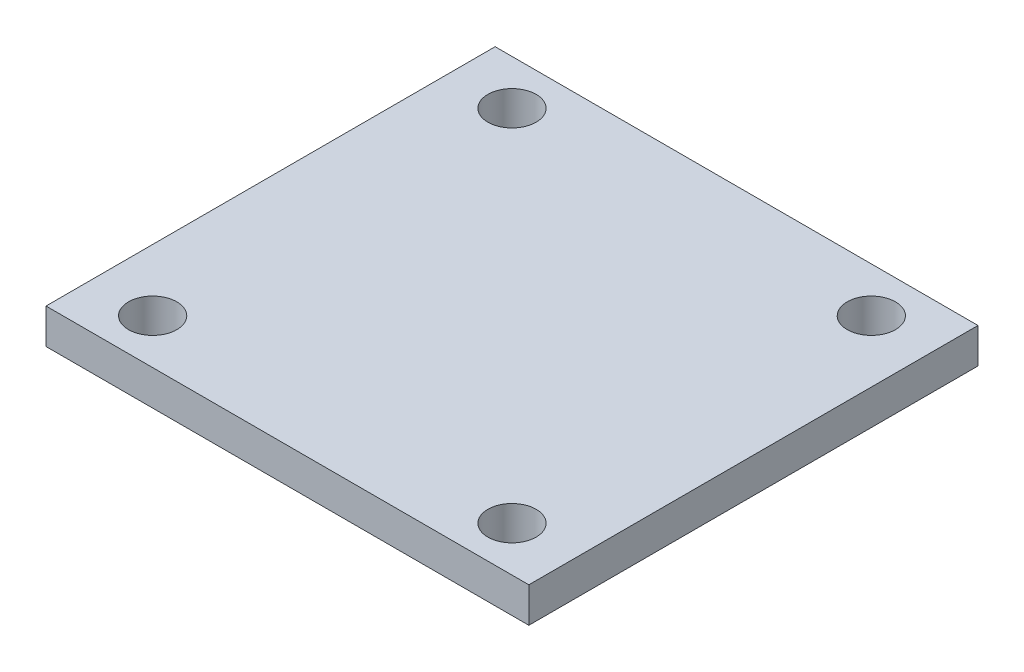
from build123d import *

# Parameters (mm, degrees)
SKETCH1_W            = 43
SKETCH1_H            = 40
BOSS_EXTRUDE1_DEPTH  = 3.125
M4_CLEARANCE_HOLE1_D = 4.3


with BuildPart() as part:
    # Sketch1 → Boss-Extrude1 (new body)
    with BuildSketch(Plane(origin=(0, 0, 0), x_dir=(1, 0, 0), z_dir=(0, 1, 0))):
        Rectangle(SKETCH1_W, SKETCH1_H)
    extrude(amount=BOSS_EXTRUDE1_DEPTH)

    # M4 Clearance Hole1 (through all)
    with Locations(Plane(origin=(0, 3.125, 0), x_dir=(1, 0, 0), z_dir=(0, 1, 0))):
        with Locations((-16, 16), (16, 16), (16, -16), (-16, -16)):
            Hole(M4_CLEARANCE_HOLE1_D / 2)


solid = part.part
